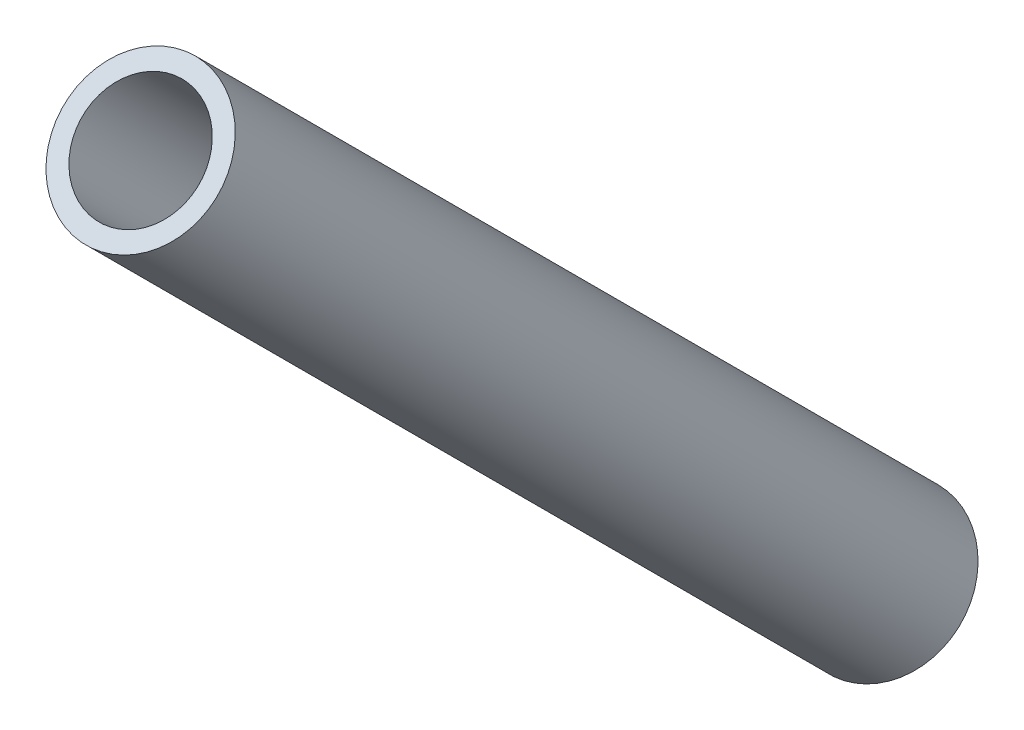
from build123d import *

# Parameters (mm, degrees)
SKETCH9_R           = 13.081
BOSS_EXTRUDE2_DEPTH = 177.8
SKETCH3_R           = 9.906
CUT_EXTRUDE1_DEPTH  = 171.45
CUT_EXTRUDE2_DEPTH  = 206.013596075


with BuildPart() as part:
    # Sketch9 → Boss-Extrude2 (new body)
    with BuildSketch(Plane(origin=(0, 0, 0), x_dir=(1, 0, 0), z_dir=(0, 0.7071067811865464, 0.7071067811865487))):
        with Locations(Location((0, 0, 0), (0, 0, 90))):
            Circle(SKETCH9_R)
    extrude(amount=BOSS_EXTRUDE2_DEPTH)

    # Sketch3 → Cut-Extrude1 (cut)
    with BuildSketch(Plane(origin=(0, 429.24717139, -177.8), x_dir=(1, 0, 0), z_dir=(0, -0.7071067811865464, -0.7071067811865487))):
        with Locations(Location((0, 429.24717139, 0), (0, 0, 270))):
            Circle(SKETCH3_R)
    extrude(amount=CUT_EXTRUDE1_DEPTH, mode=Mode.SUBTRACT)

    # Sketch5 → Cut-Extrude2 (cut, through all)
    with BuildSketch(Plane(origin=(0, 52.076414305, -52.076414305), x_dir=(-1, 0, 0), z_dir=(0, -0.7071067811865464, -0.7071067811865487))):
        with BuildLine():
            Line((-1.524, -64.94767139), (1.524, -64.94767139))
            Line((1.524, -64.94767139), (1.524, -68.867768054))
            ThreePointArc((1.524, -68.867768054), (5.0165, -73.64717139), (1.524, -78.426574726))
            Line((1.524, -78.426574726), (1.524, -82.34667139))
            Line((1.524, -82.34667139), (-1.524, -82.34667139))
            Line((-1.524, -82.34667139), (-1.524, -78.426574726))
            ThreePointArc((-1.524, -78.426574726), (-5.0165, -73.64717139), (-1.524, -68.867768054))
            Line((-1.524, -68.867768054), (-1.524, -64.94767139))
        make_face()
    extrude(amount=-CUT_EXTRUDE2_DEPTH, mode=Mode.SUBTRACT)


solid = part.part
